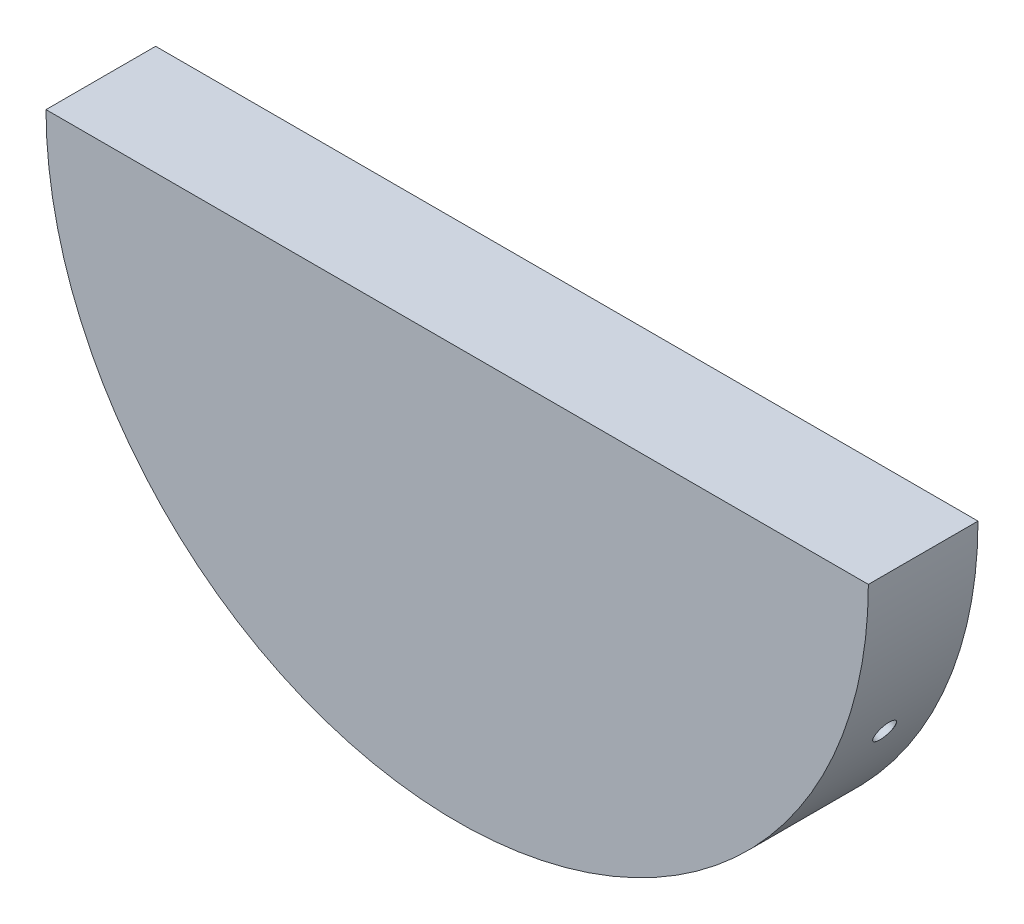
from build123d import *

# Parameters (mm, degrees)
BOSS_EXTRUDE1_DEPTH = 20
CIRPATTERN1_COUNT   = 5
CIRPATTERN1_ANGLE   = 130


with BuildPart() as part:
    # Sketch1 → Boss-Extrude1 (new body)
    with BuildSketch(Plane.XY):
        with BuildLine():
            Line((-150, 0), (0, 0))
            ThreePointArc((0, 0), (-75, -75), (-150, 0))
        make_face()
    extrude(amount=BOSS_EXTRUDE1_DEPTH)

    # Sketch4 → Ø4.0mm Dowel Hole2 (revolve, cut)
    with BuildSketch(Plane(origin=(-7.026915972, -31.696369631, 10), x_dir=(0.4226182617407001, 0.9063077870366498, 0), z_dir=(0, 0, 1))):
        Polygon((0, 0), (0, 17.201721238), (2, 16), (2, 0.025), (2.025, 0), align=None)
    f_4_0mm_dowel_hole2 = revolve(axis=Axis((-1.271861525, -34.379995593, 10), (-0.9063077870366497, 0.42261826174070016, 0)), mode=Mode.SUBTRACT)

    # CirPattern1: Ø4.0mm Dowel Hole2 ×5 about axis
    cirpattern1_axis = Axis((-75, 0, 0), (0, 0, -1))
    for i in range(1, CIRPATTERN1_COUNT):
        add(f_4_0mm_dowel_hole2.rotate(cirpattern1_axis, i * CIRPATTERN1_ANGLE / (CIRPATTERN1_COUNT - 1)), mode=Mode.SUBTRACT)


solid = part.part
